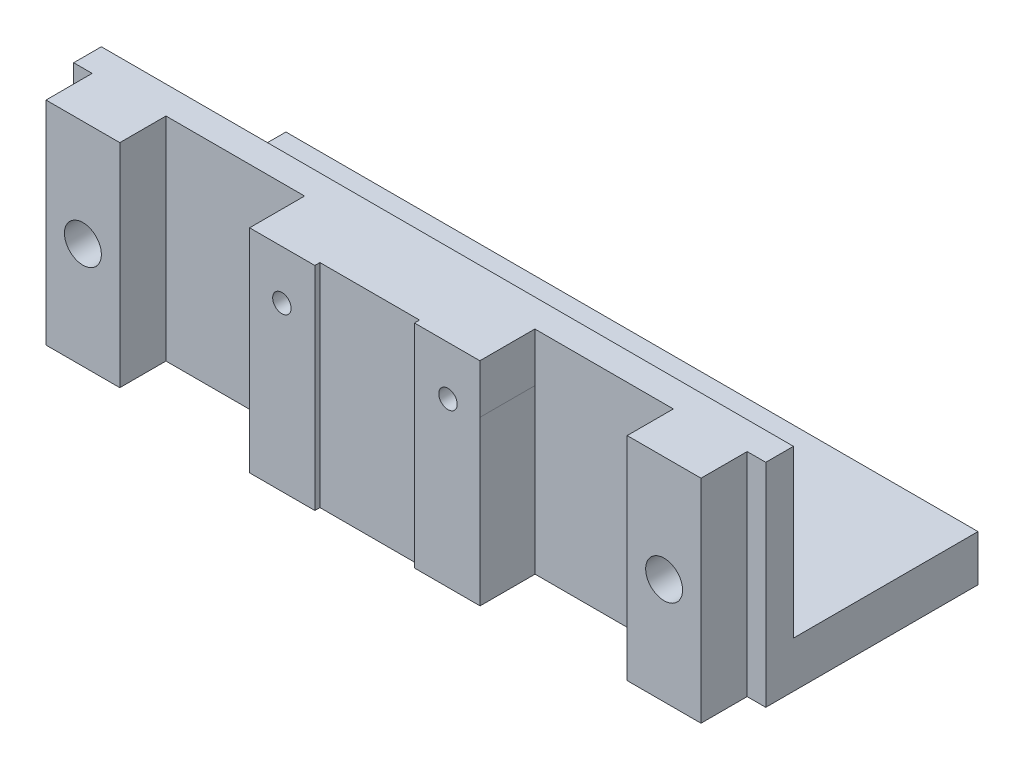
from build123d import *

# Parameters (mm, degrees)
SKETCH1_W            = 50
SKETCH1_H            = 23
BOSS_EXTRUDE12_DEPTH = 3
SKETCH17_W           = 50
SKETCH17_H           = 3
BOSS_EXTRUDE13_DEPTH = 20
BOSS_EXTRUDE15_DEPTH = 25
SKETCH19_R           = 3
CUT_EXTRUDE1_DEPTH   = 10
BOSS_EXTRUDE17_DEPTH = 5.96
CUT_EXTRUDE2_DEPTH   = 58.739515066
SKETCH23_R           = 1
CUT_EXTRUDE3_DEPTH   = 63.190687406
SKETCH24_W           = 8
SKETCH24_H           = 23
BOSS_EXTRUDE20_DEPTH = 5
BOSS_EXTRUDE22_START = 3
SKETCH20_R           = 4
SKETCH20_R_2         = 3
BOSS_EXTRUDE22_DEPTH = 3
SKETCH25_R           = 2
CUT_EXTRUDE4_DEPTH   = 62.749493925
SKETCH26_W           = 75
SKETCH26_H           = 20
BOSS_EXTRUDE23_DEPTH = 2
SKETCH27_R           = 3
CUT_EXTRUDE5_DEPTH   = 57.611408744


with BuildPart() as part:
    # Sketch1 → Boss-Extrude12 (new body)
    with BuildSketch(Plane(origin=(0, 0, 0), x_dir=(1, 0, 0), z_dir=(0, 1, 0))):
        Rectangle(SKETCH1_W, SKETCH1_H)
    extrude(amount=BOSS_EXTRUDE12_DEPTH)

    # Sketch17 → Boss-Extrude13 (add)
    with BuildSketch(Plane(origin=(0, 3, 0), x_dir=(1, 0, 0), z_dir=(0, 1, 0))):
        with Locations((0, -10)):
            Rectangle(SKETCH17_W, SKETCH17_H)
    extrude(amount=BOSS_EXTRUDE13_DEPTH)

    # Sketch18 → Boss-Extrude15 (add)
    with BuildSketch(Plane(origin=(25, 0, 0), x_dir=(0, 0, -1), z_dir=(1, 0, 0))):
        Polygon((-11.5, 23), (-8.5, 23), (-8.5, 3), (11.5, 3), (11.5, 0), (-11.5, 0), align=None)
    extrude(amount=BOSS_EXTRUDE15_DEPTH)

    # Sketch19 → Cut-Extrude1 (cut)
    with BuildSketch(Plane.XZ):
        with Locations(Location((-7.5, -1.069311776, 0), (0, 0, 270))):
            Circle(SKETCH19_R)
        with Locations(Location((12.5, -1.069311776, 0), (0, 0, 270))):
            Circle(SKETCH19_R)
        with Locations(Location((32.5, -1.069311776, 0), (0, 0, 270))):
            Circle(SKETCH19_R)
    extrude(amount=-CUT_EXTRUDE1_DEPTH, mode=Mode.SUBTRACT)

    # Sketch21 → Boss-Extrude17 (add)
    with BuildSketch(Plane.XY.offset(11.5)):
        Polygon((0.022791851, 17.683942334), (0, 0), (25, 0), (24.977208149, 17.683942334), (24.977208149, 23), (0.022791851, 23), align=None)
    extrude(amount=BOSS_EXTRUDE17_DEPTH)

    # Sketch22 → Cut-Extrude2 (cut, through all)
    with BuildSketch(Plane(origin=(0, 23, 0), x_dir=(1, 0, 0), z_dir=(0, 1, 0))):
        Polygon((15.892859801, -16.90901318), (17.890847614, -16.90901318), (17.890847614, -17.46), (7.092859801, -17.46), (7.092859801, -16.90901318), (9.092859801, -16.90901318), align=None)
    extrude(amount=-CUT_EXTRUDE2_DEPTH, mode=Mode.SUBTRACT)

    # Sketch23 → Cut-Extrude3 (cut, through all)
    with BuildSketch(Plane.XY.offset(17.46)):
        with Locations((3.522791851, 17.683942334)):
            Circle(SKETCH23_R)
        with Locations((21.522791851, 17.683942334)):
            Circle(SKETCH23_R)
    extrude(amount=-CUT_EXTRUDE3_DEPTH, mode=Mode.SUBTRACT)

    # Sketch24 → Boss-Extrude20 (add)
    with BuildSketch(Plane.XY.offset(11.5)):
        with Locations((-19, 11.5)):
            Rectangle(SKETCH24_W, SKETCH24_H)
        with Locations((43.983707415, 11.5)):
            Rectangle(SKETCH24_W, SKETCH24_H)
    extrude(amount=BOSS_EXTRUDE20_DEPTH)

    # Sketch20 → Boss-Extrude22 (add)
    # profile 1 of 3: a face of its own
    with BuildSketch(Plane.XZ.offset(BOSS_EXTRUDE22_START)):
        with Locations(Location((-7.5, -1.069311776, 0), (0, 0, 270))):
            Circle(SKETCH20_R)
        with Locations(Location((-7.5, -1.069311776, 0), (0, 0, 270))):
            Circle(SKETCH20_R_2, mode=Mode.SUBTRACT)
    # profile 2 of 3: a face of its own
    with BuildSketch(Plane.XZ.offset(BOSS_EXTRUDE22_START)):
        with Locations(Location((12.5, -1.069311776, 0), (0, 0, 270))):
            Circle(SKETCH20_R)
        with Locations(Location((12.5, -1.069311776, 0), (0, 0, 270))):
            Circle(SKETCH20_R_2, mode=Mode.SUBTRACT)
    # profile 3 of 3: a face of its own
    with BuildSketch(Plane.XZ.offset(BOSS_EXTRUDE22_START)):
        with Locations(Location((32.5, -1.069311776, 0), (0, 0, 270))):
            Circle(SKETCH20_R)
        with Locations(Location((32.5, -1.069311776, 0), (0, 0, 270))):
            Circle(SKETCH20_R_2, mode=Mode.SUBTRACT)
    extrude(amount=-BOSS_EXTRUDE22_DEPTH)

    # Sketch25 → Cut-Extrude4 (cut, through all)
    with BuildSketch(Plane.XY.offset(16.5)):
        with Locations((43.984708093, 11.497259352)):
            Circle(SKETCH25_R)
        with Locations((-19, 11.5)):
            Circle(SKETCH25_R)
    extrude(amount=-CUT_EXTRUDE4_DEPTH, mode=Mode.SUBTRACT)

    # Sketch26 → Boss-Extrude23 (add)
    with BuildSketch(Plane(origin=(0, 3, 0), x_dir=(1, 0, 0), z_dir=(0, 1, 0))):
        with Locations((12.5, 1.5)):
            Rectangle(SKETCH26_W, SKETCH26_H)
    extrude(amount=BOSS_EXTRUDE23_DEPTH)

    # Sketch27 → Cut-Extrude5 (cut, through all)
    with BuildSketch(Plane.XZ.offset(-3)):
        with Locations(Location((-7.5, -1.069311776, 0), (0, 0, 270))):
            Circle(SKETCH27_R)
        with Locations(Location((12.5, -1.069311776, 0), (0, 0, 270))):
            Circle(SKETCH27_R)
        with Locations(Location((32.5, -1.069311776, 0), (0, 0, 270))):
            Circle(SKETCH27_R)
    extrude(amount=-CUT_EXTRUDE5_DEPTH, mode=Mode.SUBTRACT)


solid = part.part
